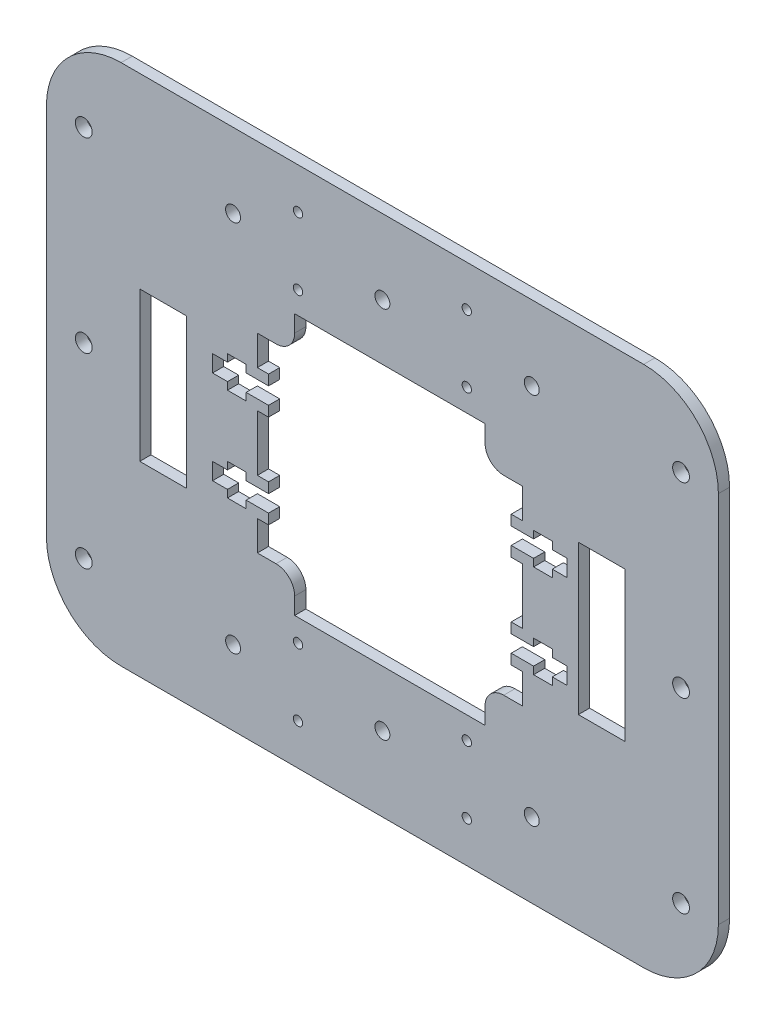
from build123d import *

# Parameters (mm, degrees)
SKETCH_1_W          = 180
SKETCH_1_H          = 140
SKETCH_1_W_2        = 71
SKETCH_1_H_2        = 70
SKETCH_1_W_3        = 10
SKETCH_1_H_3        = 9.5
EXTRUDE_1_DEPTH     = 1.5
FILLET_1_R          = 20
FILLET_2_R          = 5
SKETCH_2_W          = 12.5
SKETCH_2_H          = 40
CUT_EXTRUDE_1_DEPTH = 3
SKETCH_3_W          = 3
SKETCH_3_H          = 10
EXTRUDE_2_DEPTH     = 3
CUT_EXTRUDE_2_DEPTH = 3
SKETCH_6_R          = 2.25
SKETCH_6_R_2        = 1.25
SKETCH_6_R_3        = 2
CUT_EXTRUDE_3_DEPTH = 10


with BuildPart() as part:
    # 草图1 → 凸台-拉伸1 (new, symmetric)
    # profile 1 of 5: a face of its own
    with BuildSketch(Plane.XY):
        Rectangle(SKETCH_1_W, SKETCH_1_H)
        with Locations((2, 0)):
            Rectangle(SKETCH_1_W_2, SKETCH_1_H_2, mode=Mode.SUBTRACT)
    # profile 2 of 5: a face of its own
    with BuildSketch(Plane.XY):
        with Locations((-28.5, -30.25)):
            Rectangle(SKETCH_1_W_3, SKETCH_1_H_3)
    # profile 3 of 5: a face of its own
    with BuildSketch(Plane.XY):
        with Locations((32.5, -30.25)):
            Rectangle(SKETCH_1_W_3, SKETCH_1_H_3)
    # profile 4 of 5: a face of its own
    with BuildSketch(Plane.XY):
        with Locations((32.5, 30.25)):
            Rectangle(SKETCH_1_W_3, SKETCH_1_H_3)
    # profile 5 of 5: a face of its own
    with BuildSketch(Plane.XY):
        with Locations((-28.5, 30.25)):
            Rectangle(SKETCH_1_W_3, SKETCH_1_H_3)
    extrude(amount=EXTRUDE_1_DEPTH, both=True)

    # 圆角1
    fillet_1_edges = [part.edges().sort_by_distance(p)[0] for p in [
        (90, -70, 0),
        (-90, -70, 0),
        (-90, 70, 0),
        (90, 70, 0),
    ]]
    fillet(fillet_1_edges, radius=FILLET_1_R)

    # 圆角2
    fillet_2_edges = [part.edges().sort_by_distance(p)[0] for p in [
        (-23.5, 25.5, 0),
        (-23.5, -25.5, 0),
        (27.5, -25.5, 0),
        (27.5, 25.5, 0),
    ]]
    fillet(fillet_2_edges, radius=FILLET_2_R)

    # 草图2 → 切除-拉伸1 (cut)
    with BuildSketch(Plane.XY.offset(1.5)):
        with Locations((58.75, 0)):
            Rectangle(SKETCH_2_W, SKETCH_2_H)
    cut_extrude_1 = extrude(amount=-CUT_EXTRUDE_1_DEPTH, mode=Mode.SUBTRACT)

    # 草图3 → 凸台-拉伸2 (add)
    with BuildSketch(Plane.XY.offset(1.5)):
        with Locations((-32, 12.5)):
            Rectangle(SKETCH_3_W, SKETCH_3_H)
        with Locations((36, -12.5)):
            Rectangle(SKETCH_3_W, SKETCH_3_H)
        with Locations((-32, -12.5)):
            Rectangle(SKETCH_3_W, SKETCH_3_H)
        with Locations((36, 12.5)):
            Rectangle(SKETCH_3_W, SKETCH_3_H)
    extrude(amount=-EXTRUDE_2_DEPTH)

    # 草图5 → 切除-拉伸2 (cut)
    with BuildSketch(Plane.XY.offset(1.5)):
        Polygon((-30.5, 14.75), (-36.5, 14.75), (-36.5, 16.75), (-41.5, 16.75), (-41.5, 14.75), (-45.5, 14.75), (-45.5, 10.25), (-41.5, 10.25), (-41.5, 8.25), (-36.5, 8.25), (-36.5, 10.25), (-30.5, 10.25), align=None)
        Polygon((-36.5, -10.25), (-30.5, -10.25), (-30.5, -14.75), (-36.5, -14.75), (-36.5, -16.75), (-41.5, -16.75), (-41.5, -14.75), (-45.5, -14.75), (-45.5, -10.25), (-41.5, -10.25), (-41.5, -8.25), (-36.5, -8.25), align=None)
        Polygon((40.5, -8.25), (40.5, -10.25), (34.5, -10.25), (34.5, -14.75), (40.5, -14.75), (40.5, -16.75), (45.5, -16.75), (45.5, -14.75), (49.5, -14.75), (49.5, -10.25), (45.5, -10.25), (45.5, -8.25), align=None)
        Polygon((40.5, 10.25), (34.5, 10.25), (34.5, 14.75), (40.5, 14.75), (40.5, 16.75), (45.5, 16.75), (45.5, 14.75), (49.5, 14.75), (49.5, 10.25), (45.5, 10.25), (45.5, 8.25), (40.5, 8.25), align=None)
    extrude(amount=-CUT_EXTRUDE_2_DEPTH, mode=Mode.SUBTRACT)

    # 草图6 → 切除-拉伸3 (cut)
    with BuildSketch(Plane.XY.offset(1.5)):
        with Locations((-80, 50)):
            Circle(SKETCH_6_R)
        with Locations((80, 50)):
            Circle(SKETCH_6_R)
        with Locations((80, -50)):
            Circle(SKETCH_6_R)
        with Locations((-80, -50)):
            Circle(SKETCH_6_R)
        with Locations((-22.605, -41)):
            Circle(SKETCH_6_R_2)
        with Locations((22.605, -41)):
            Circle(SKETCH_6_R_2)
        with Locations((22.605, -59)):
            Circle(SKETCH_6_R_2)
        with Locations((-22.605, -59)):
            Circle(SKETCH_6_R_2)
        with Locations((22.605, 59)):
            Circle(SKETCH_6_R_2)
        with Locations((22.605, 41)):
            Circle(SKETCH_6_R_2)
        with Locations((-22.605, 41)):
            Circle(SKETCH_6_R_2)
        with Locations((-22.605, 59)):
            Circle(SKETCH_6_R_2)
        with Locations((0, 50)):
            Circle(SKETCH_6_R_3)
        with Locations((40, 50)):
            Circle(SKETCH_6_R_3)
        with Locations((-40, 50)):
            Circle(SKETCH_6_R_3)
        with Locations((0, -50)):
            Circle(SKETCH_6_R_3)
        with Locations((40, -50)):
            Circle(SKETCH_6_R_3)
        with Locations((-40, -50)):
            Circle(SKETCH_6_R_3)
        with Locations((-80, 0)):
            Circle(SKETCH_6_R)
        with Locations((80, 0)):
            Circle(SKETCH_6_R)
    extrude(amount=-CUT_EXTRUDE_3_DEPTH, mode=Mode.SUBTRACT)

    # 镜向1: 切除-拉伸1 across plane
    add(cut_extrude_1.mirror(Plane(origin=(0, 0, 0), x_dir=(0, 0, 1), z_dir=(1, 0, 0))), mode=Mode.SUBTRACT)


solid = part.part
